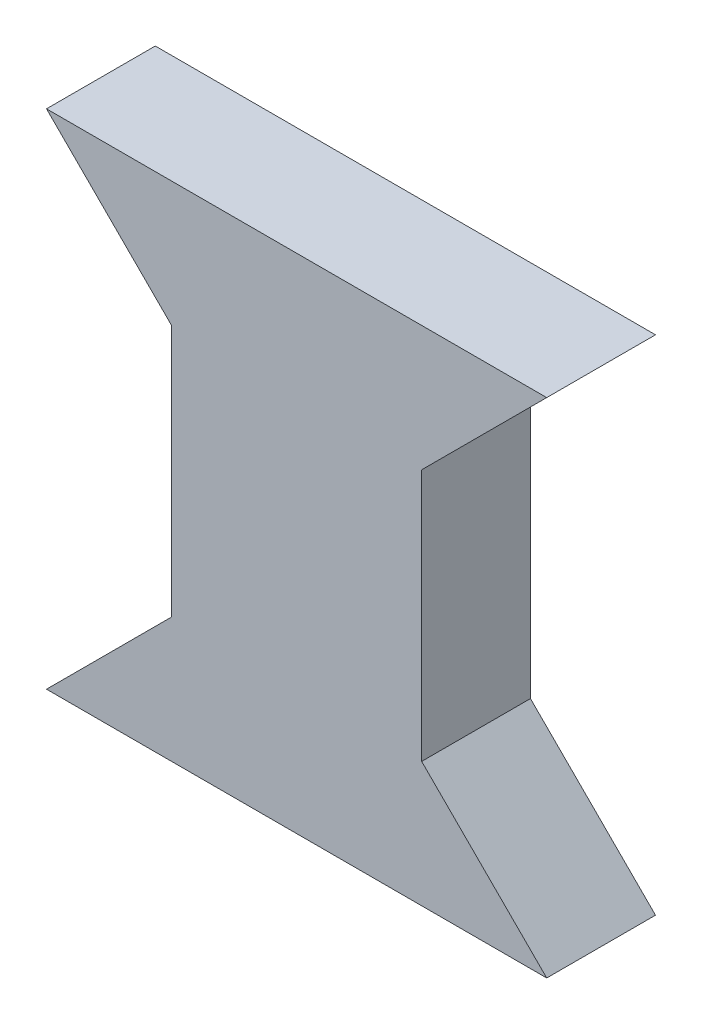
from build123d import *

# Parameters (mm, degrees)
EXTRUDE_1_DEPTH = 10


with BuildPart() as part:
    # Эскиз1 → Бобышка-Вытянуть1 (new body)
    with BuildSketch(Plane.XY):
        Polygon((22.992900916, 24.931620314), (-22.992900916, 24.931620314), (-11.496450458, 13.435169856), (-11.496450458, -9.780272637), (-22.992900916, -21.276723096), (22.992900916, -21.276723096), (11.496450458, -9.780272637), (11.496450458, 13.435169856), align=None)
    extrude(amount=EXTRUDE_1_DEPTH)


solid = part.part
